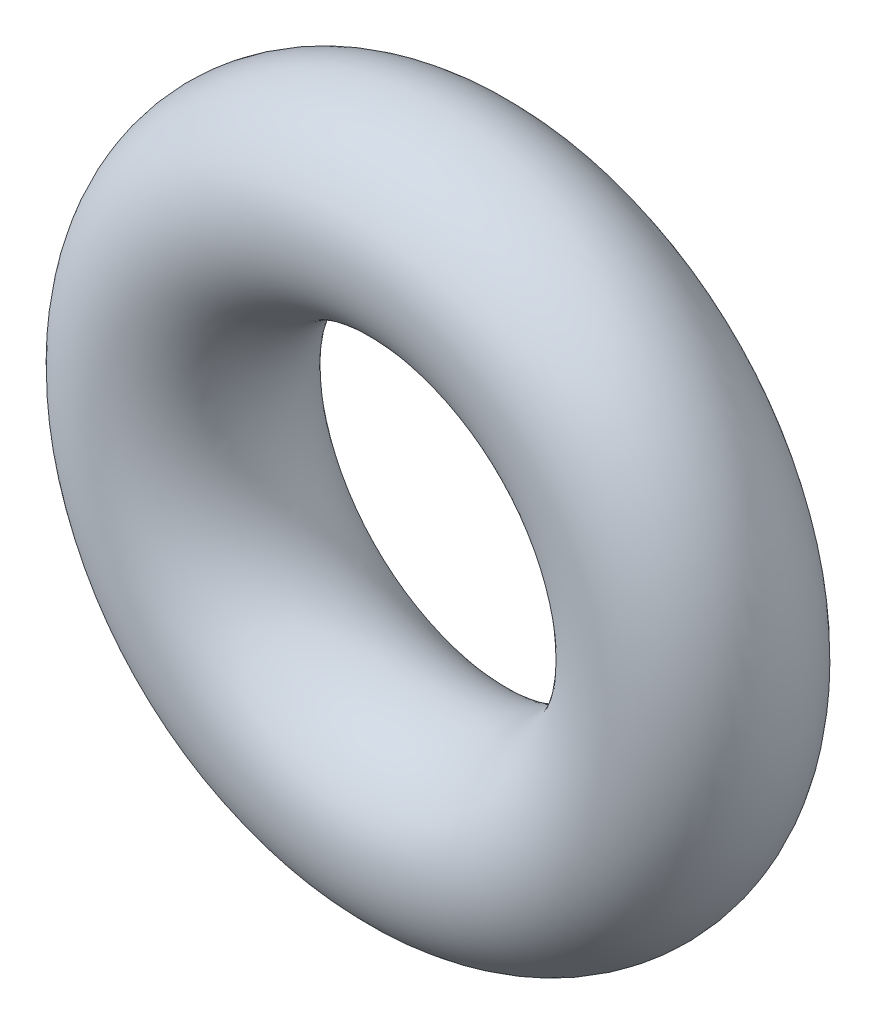
from build123d import *

# Parameters (mm, degrees)
SKETCH_1_R = 0.95


with BuildPart() as part:
    # Эскиз1 → Повернуть1 (revolve)
    with BuildSketch(Plane(origin=(0, 0, 0), x_dir=(1, 0, 0), z_dir=(0, 1, 0))):
        with Locations((2.5, 0)):
            Circle(SKETCH_1_R)
    revolve(axis=Axis((0, 0, 0), (0, 0, -1)))


solid = part.part
